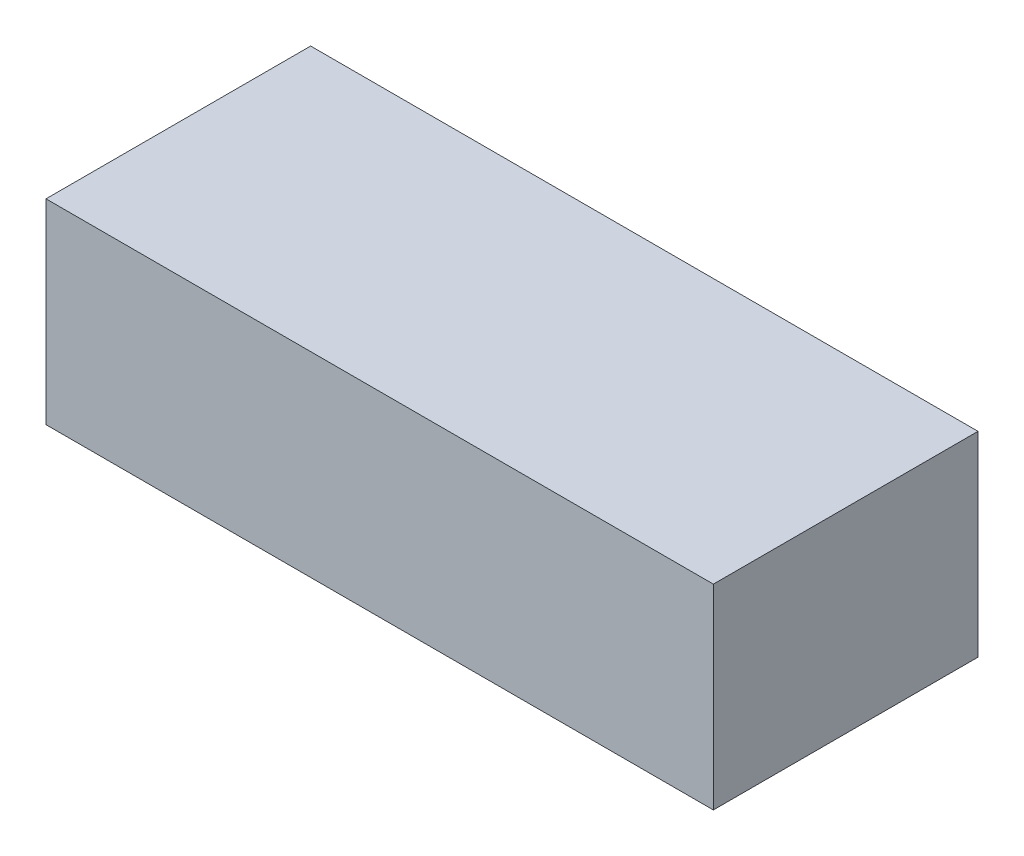
from build123d import *

# Parameters (mm, degrees)
CROQUIS1_W              = 58
CROQUIS1_H              = 17
SALIENTE_EXTRUIR1_DEPTH = 23


with BuildPart() as part:
    # Croquis1 → Saliente-Extruir1 (new body)
    with BuildSketch(Plane.XY):
        with Locations((29, 8.5)):
            Rectangle(CROQUIS1_W, CROQUIS1_H)
    extrude(amount=-SALIENTE_EXTRUIR1_DEPTH)


solid = part.part
